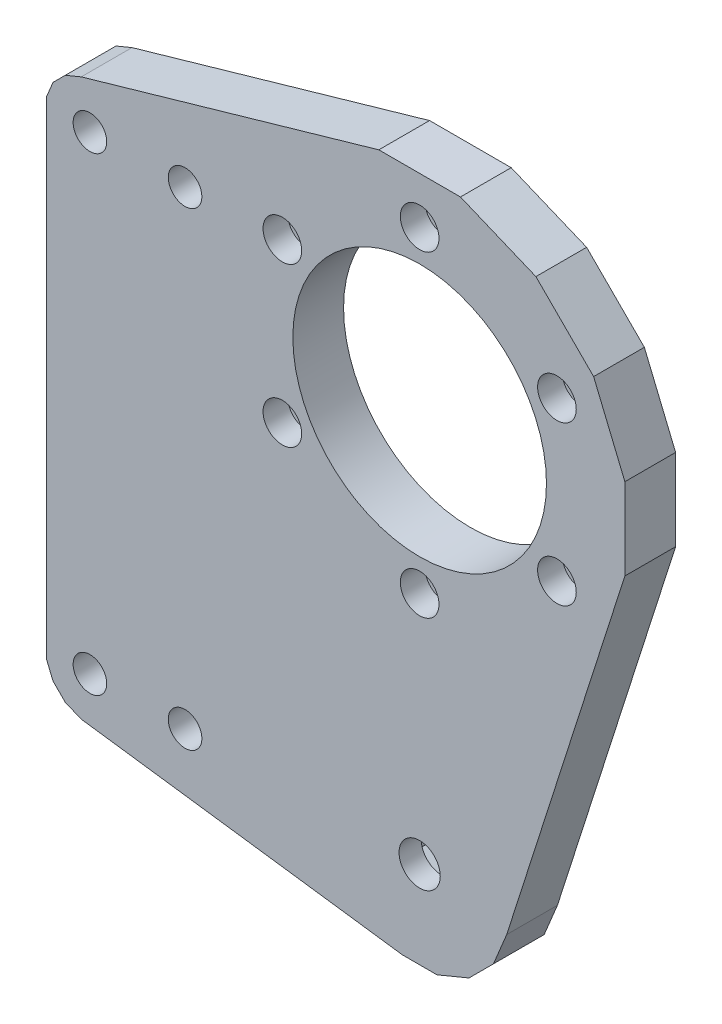
from build123d import *

# Parameters (mm, degrees)
FRAME_AND_BENCH_INTERFACE_START = -1
PROFILE_1_R                     = 20
PROFILE_1_R_2                   = 3.25
PROFILE_1_R_3                   = 1.65
PROFILE_1_R_4                   = 2.65
FRAME_AND_BENCH_INTERFACE_DEPTH = 8
RECESS_STATOR_SCREW_HEADS_START = 3.1
PROFILE_2_R                     = 3.05
RECESS_STATOR_SCREW_HEADS_DEPTH = 4
REAR_CAPTIVE_NUT_B_START        = -1.01
REAR_CAPTIVE_NUT_B_DEPTH        = 4.51


with BuildPart() as part:
    # Profile_1 → Frame_and_bench_interface (new body)
    with BuildSketch(Plane.XY.offset(FRAME_AND_BENCH_INTERFACE_START)):
        Polygon((-58.865496963, 13.365632254), (-58.865496963, -63.365632254), (-57.820287286, -65.888991631), (-55.888991631, -67.820287286), (-53.365632254, -68.865496963), (-2.731264508, -75.730993926), (2.731264508, -75.730993926), (7.777983262, -73.640574572), (11.640574572, -69.777983262), (13.730993926, -64.731264508), (32.365914253, -6.437980627), (32.365914253, 6.437980627), (27.438497206, 18.33381769), (18.33381769, 27.438497206), (6.437980627, 32.365914253), (-6.437980627, 32.365914253), (-53.365632254, 18.865496963), (-55.888991631, 17.820287286), (-57.820287286, 15.888991631), align=None)
        Circle(PROFILE_1_R, mode=Mode.SUBTRACT)
        with Locations((0, -62)):
            Circle(PROFILE_1_R_2, mode=Mode.SUBTRACT)
        with Locations((21.650635095, 12.5)):
            Circle(PROFILE_1_R_3, mode=Mode.SUBTRACT)
        with Locations((0, 25)):
            Circle(PROFILE_1_R_3, mode=Mode.SUBTRACT)
        with Locations((-21.650635095, 12.5)):
            Circle(PROFILE_1_R_3, mode=Mode.SUBTRACT)
        with Locations((-21.650635095, -12.5)):
            Circle(PROFILE_1_R_3, mode=Mode.SUBTRACT)
        with Locations((0, -25)):
            Circle(PROFILE_1_R_3, mode=Mode.SUBTRACT)
        with Locations((21.650635095, -12.5)):
            Circle(PROFILE_1_R_3, mode=Mode.SUBTRACT)
        with Locations((-52, 12)):
            Circle(PROFILE_1_R_4, mode=Mode.SUBTRACT)
        with Locations((-37, 12)):
            Circle(PROFILE_1_R_4, mode=Mode.SUBTRACT)
        with Locations((-52, -62)):
            Circle(PROFILE_1_R_4, mode=Mode.SUBTRACT)
        with Locations((-37, -62)):
            Circle(PROFILE_1_R_4, mode=Mode.SUBTRACT)
    extrude(amount=FRAME_AND_BENCH_INTERFACE_DEPTH)

    # Profile_2 → Recess_stator_screw_heads (cut)
    with BuildSketch(Plane.XY.offset(RECESS_STATOR_SCREW_HEADS_START)):
        with Locations((21.650635095, 12.5)):
            Circle(PROFILE_2_R)
        with Locations((0, 25)):
            Circle(PROFILE_2_R)
        with Locations((-21.650635095, 12.5)):
            Circle(PROFILE_2_R)
        with Locations((-21.650635095, -12.5)):
            Circle(PROFILE_2_R)
        with Locations((0, -25)):
            Circle(PROFILE_2_R)
        with Locations((21.650635095, -12.5)):
            Circle(PROFILE_2_R)
    extrude(amount=RECESS_STATOR_SCREW_HEADS_DEPTH, mode=Mode.SUBTRACT)

    # Profile_3 → Rear_captive_nut_B (cut)
    with BuildSketch(Plane.XY.offset(REAR_CAPTIVE_NUT_B_START)):
        Polygon((5.175, -59.012212357), (0, -56.024424714), (-5.175, -59.012212357), (-5.175, -64.987787643), (0, -67.975575286), (5.175, -64.987787643), align=None)
    extrude(amount=REAR_CAPTIVE_NUT_B_DEPTH, mode=Mode.SUBTRACT)


solid = part.part
